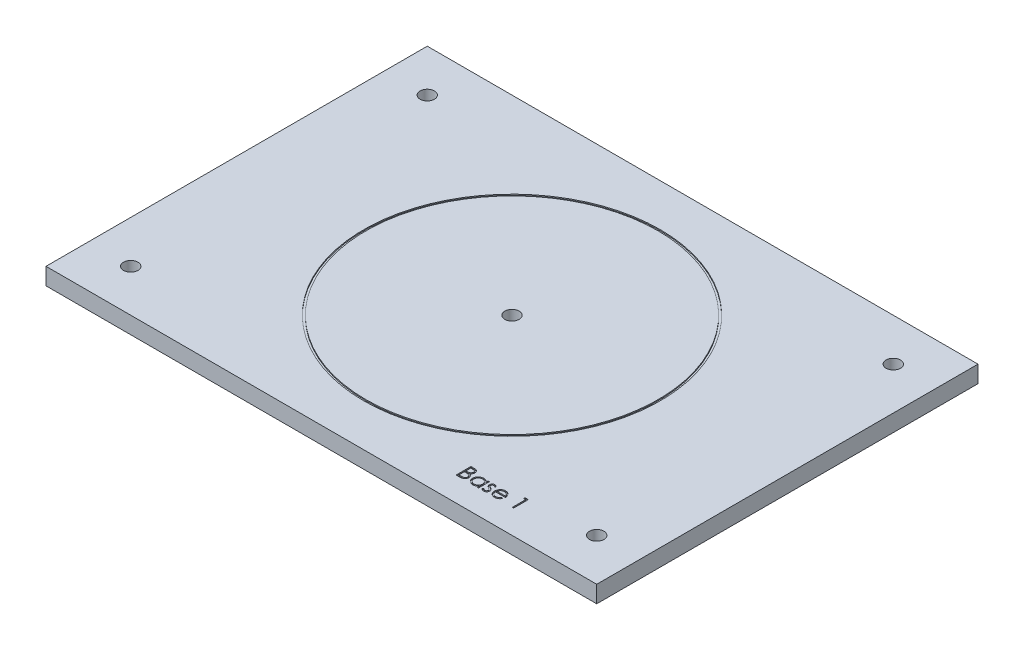
from build123d import *

# Parameters (mm, degrees)
CROQUIS1_W                       = 130
CROQUIS1_H                       = 90
SALIENTE_EXTRUIR1_DEPTH          = 2
TALADRO_DE_MARGEN_PARA_M31_D     = 3.4
TALADRO_DE_MARGEN_PARA_M31_DEPTH = 40
TALADRO_DE_MARGEN_PARA_M31_TIP   = 1.021463052
CORTAR_EXTRUIR1_DEPTH            = 0.25
CROQUIS5_R                       = 35
CROQUIS5_R_2                     = 34.5
CORTAR_EXTRUIR2_DEPTH            = 0.25
TALADRO_DE_MARGEN_PARA_M32_D     = 3.4


with BuildPart() as part:
    # Croquis1 → Saliente-Extruir1 (new, symmetric)
    with BuildSketch(Plane(origin=(0, 0, 0), x_dir=(1, 0, 0), z_dir=(0, 1, 0))):
        Rectangle(CROQUIS1_W, CROQUIS1_H)
    extrude(amount=SALIENTE_EXTRUIR1_DEPTH, both=True)

    # Taladro de margen para M31
    with Locations(Plane(origin=(0, 2, 0), x_dir=(1, 0, 0), z_dir=(0, 1, 0))):
        with Locations((-55, 35), (55, 35), (55, -35), (-55, -35)):
            Hole(TALADRO_DE_MARGEN_PARA_M31_D / 2, depth=TALADRO_DE_MARGEN_PARA_M31_DEPTH)
            with Locations((0, 0, -(TALADRO_DE_MARGEN_PARA_M31_DEPTH + TALADRO_DE_MARGEN_PARA_M31_TIP / 2))):  # 118° drill point
                Cone(0, TALADRO_DE_MARGEN_PARA_M31_D / 2, TALADRO_DE_MARGEN_PARA_M31_TIP, mode=Mode.SUBTRACT)

    # Croquis4 → Cortar-Extruir1 (cut)
    # profile 1 of 5: a face of its own
    with BuildSketch(Plane(origin=(0, 2, 0), x_dir=(1, 0, 0), z_dir=(0, 1, 0))):
        with BuildLine():
            Line((26.072765662, -35.764073187), (26.75565829, -35.764073187))
            add(Edge.make_bspline(
                [(26.75565829, -35.764073187), (26.789086768, -35.764248937), (26.853879479, -35.764589586), (26.94809892, -35.769872717), (27.036347731, -35.777076387), (27.118651503, -35.788506479), (27.194972206, -35.802298256), (27.265539843, -35.819000072), (27.330130015, -35.839026686), (27.407242752, -35.870872967), (27.495163413, -35.918196136), (27.590361805, -35.988124701), (27.671766045, -36.073657164), (27.741952362, -36.170139819), (27.797753482, -36.276275591), (27.838122779, -36.38953478), (27.863680654, -36.508456522), (27.866309088, -36.5900997), (27.867637457, -36.631360847)],
                knots=[0, 0, 0, 0, 1.001505555, 1.941167018, 2.826882275, 3.653841531, 4.429895133, 5.150066043, 5.825578002, 6.45369114, 7.647487171, 8.808567382, 9.977351308, 11.170798116, 12.373658725, 13.556498008, 14.765093433, 16, 16, 16, 16], degree=3))
            add(Edge.make_bspline(
                [(27.867637457, -36.631360847), (27.866544238, -36.670013403), (27.864395961, -36.74596932), (27.843853202, -36.857063429), (27.811692533, -36.962814648), (27.766987284, -37.062837034), (27.708885288, -37.154870647), (27.640026969, -37.239657913), (27.556950167, -37.31360897), (27.494706927, -37.354951872), (27.463090181, -37.375952194)],
                knots=[0, 0, 0, 0, 1.044552857, 2.05264487, 3.044412934, 4.028983338, 5.005914585, 5.980388656, 6.974128949, 8, 8, 8, 8], degree=3))
            add(Edge.make_bspline(
                [(27.463090181, -37.375952194), (27.502850609, -37.391217192), (27.578922156, -37.420422917), (27.683608169, -37.472058381), (27.773803014, -37.528220491), (27.85020016, -37.589552341), (27.915537814, -37.655661152), (27.972590756, -37.727516266), (28.02127213, -37.806055024), (28.062985054, -37.89045856), (28.09553381, -37.979865028), (28.119909714, -38.073435804), (28.133877163, -38.170835359), (28.135864805, -38.237120739), (28.136868226, -38.270583604)],
                knots=[0, 0, 0, 0, 1.27268992, 2.434971085, 3.483601985, 4.442670788, 5.356604649, 6.2567628, 7.179492994, 8.113709626, 9.066344395, 10.018646069, 10.999752585, 12, 12, 12, 12], degree=3))
            add(Edge.make_bspline(
                [(28.136868226, -38.270583604), (28.13589138, -38.304750476), (28.133969408, -38.371974754), (28.119789436, -38.470729889), (28.095780329, -38.565104835), (28.062709183, -38.655710018), (28.019546868, -38.742370152), (27.967018904, -38.825183416), (27.90438734, -38.903317747), (27.834324471, -38.97764137), (27.755062326, -39.044469157), (27.669546571, -39.103984864), (27.576700251, -39.152930926), (27.478048257, -39.194046948), (27.372483941, -39.225454146), (27.260481334, -39.24742672), (27.142137032, -39.262231757), (27.060927281, -39.263448962), (27.019280085, -39.264073187)],
                knots=[0, 0, 0, 0, 0.978564426, 1.925352924, 2.850884081, 3.763762016, 4.682927383, 5.618979971, 6.567305752, 7.547517671, 8.540179244, 9.531824382, 10.526200242, 11.540722885, 12.589160233, 13.674978461, 14.80764778, 16, 16, 16, 16], degree=3))
            Line((27.019280085, -39.264073187), (26.072765662, -39.264073187))
            Line((26.072765662, -39.264073187), (26.072765662, -35.764073187))
        make_face()
        with BuildLine():
            Line((26.386868226, -36.123047546), (26.386868226, -37.244842418))
            Line((26.386868226, -37.244842418), (26.597905886, -37.244842418))
            add(Edge.make_bspline(
                [(26.597905886, -37.244842418), (26.628754682, -37.244442495), (26.688360841, -37.243669762), (26.774680737, -37.241456245), (26.854805756, -37.235258202), (26.928597589, -37.22906194), (26.995940033, -37.218987352), (27.056683894, -37.206995229), (27.111782491, -37.194312324), (27.175322037, -37.172742837), (27.247394985, -37.140865162), (27.324228089, -37.091393326), (27.391962559, -37.032468973), (27.449159747, -36.964478011), (27.495971217, -36.889611825), (27.528484932, -36.809064944), (27.550532216, -36.724844812), (27.552523748, -36.66702656), (27.553534893, -36.637670944)],
                knots=[0, 0, 0, 0, 1.156816544, 2.235205308, 3.236616184, 4.169592532, 5.011045266, 5.787822928, 6.49130361, 7.128639758, 8.301311294, 9.436451833, 10.541879658, 11.654887649, 12.756523258, 13.837046038, 14.901820046, 16, 16, 16, 16], degree=3))
            add(Edge.make_bspline(
                [(27.553534893, -36.637670944), (27.553008713, -36.618245172), (27.551976553, -36.5801394), (27.54352325, -36.524590046), (27.529155676, -36.472346293), (27.510701382, -36.422692183), (27.484912694, -36.377180333), (27.45454923, -36.334237137), (27.41786354, -36.295325018), (27.376106227, -36.25895552), (27.328097605, -36.226710992), (27.273866313, -36.198470229), (27.212678636, -36.175729453), (27.145565781, -36.1558133), (27.071494693, -36.141825006), (26.99132014, -36.130171619), (26.904385421, -36.124238877), (26.844240318, -36.123453514), (26.813150277, -36.123047546)],
                knots=[0, 0, 0, 0, 0.91205012, 1.789085906, 2.630437955, 3.453916878, 4.269457761, 5.079663411, 5.91843418, 6.774407191, 7.675494373, 8.627863946, 9.638891023, 10.736472738, 11.911756761, 13.175263542, 14.539845004, 16, 16, 16, 16], degree=3))
            Line((26.813150277, -36.123047546), (26.386868226, -36.123047546))
        make_face(mode=Mode.SUBTRACT)
        with BuildLine():
            Line((26.386868226, -37.603816777), (26.386868226, -38.905098828))
            Line((26.386868226, -38.905098828), (26.834183931, -38.905098828))
            add(Edge.make_bspline(
                [(26.834183931, -38.905098828), (26.866202857, -38.904715081), (26.927915116, -38.903975458), (27.017016346, -38.901560904), (27.09959945, -38.896068628), (27.175287585, -38.887422778), (27.244898038, -38.878044329), (27.307595741, -38.865433048), (27.363888934, -38.850984088), (27.429163242, -38.828649915), (27.50266675, -38.793953445), (27.581877607, -38.741639218), (27.652303825, -38.67931591), (27.712109084, -38.607184996), (27.761122073, -38.528753669), (27.796777528, -38.445608319), (27.818768385, -38.359122792), (27.821430554, -38.300156079), (27.822765662, -38.270583604)],
                knots=[0, 0, 0, 0, 1.160039823, 2.235823828, 3.228722157, 4.157150951, 4.99529583, 5.772374946, 6.472645482, 7.099169577, 8.269452708, 9.405989375, 10.527446681, 11.663510218, 12.788923519, 13.866172445, 14.929861265, 16, 16, 16, 16], degree=3))
            add(Edge.make_bspline(
                [(27.822765662, -38.270583604), (27.822489558, -38.252090263), (27.821941802, -38.215401881), (27.813681188, -38.161486062), (27.801667318, -38.109260189), (27.786135884, -38.058582448), (27.763516417, -38.010369072), (27.737109872, -37.963666513), (27.70614847, -37.918413033), (27.657904304, -37.86120078), (27.58773232, -37.795283767), (27.488025544, -37.730746265), (27.374653246, -37.678698457), (27.292425753, -37.656598981), (27.249949156, -37.645182963)],
                knots=[0, 0, 0, 0, 0.723448775, 1.435228256, 2.130040452, 2.821711965, 3.505591119, 4.210454504, 4.921174351, 5.648778258, 7.137944449, 8.670945889, 10.280296675, 12, 12, 12, 12], degree=3))
            add(Edge.make_bspline(
                [(27.249949156, -37.645182963), (27.23292006, -37.641727879), (27.195997467, -37.634236544), (27.135789887, -37.626328841), (27.067054018, -37.619283781), (26.989631141, -37.614072623), (26.9034233, -37.60868608), (26.808246381, -37.606591258), (26.704489066, -37.604091998), (26.632496694, -37.603910864), (26.595101399, -37.603816777)],
                knots=[0, 0, 0, 0, 0.634451884, 1.375622551, 2.216452059, 3.157844607, 4.20941857, 5.370758133, 6.634282058, 8, 8, 8, 8], degree=3))
            Line((26.595101399, -37.603816777), (26.386868226, -37.603816777))
        make_face(mode=Mode.SUBTRACT)
    # profile 2 of 5: a face of its own
    with BuildSketch(Plane(origin=(0, 2, 0), x_dir=(1, 0, 0), z_dir=(0, 1, 0))):
        with BuildLine():
            Line((31.367637457, -36.706380879), (31.367637457, -39.264073187))
            Line((31.367637457, -39.264073187), (31.053534893, -39.264073187))
            Line((31.053534893, -39.264073187), (31.053534893, -38.821665335))
            add(Edge.make_bspline(
                [(31.053534893, -38.821665335), (31.018116102, -38.861704928), (30.948995887, -38.9398427), (30.833554769, -39.041924872), (30.711186591, -39.126303194), (30.58248527, -39.194453109), (30.447567026, -39.245645166), (30.306730939, -39.282031325), (30.159919558, -39.30542516), (30.059667203, -39.307761182), (30.008863418, -39.308944982)],
                knots=[0, 0, 0, 0, 1.074387032, 2.096679803, 3.090159297, 4.057316773, 5.018401886, 5.985159533, 6.978961417, 8, 8, 8, 8], degree=3))
            add(Edge.make_bspline(
                [(30.008863418, -39.308944982), (29.963695464, -39.30771861), (29.87462226, -39.305300149), (29.743593182, -39.286537846), (29.617500933, -39.256407224), (29.49622636, -39.214506335), (29.380554215, -39.158925513), (29.269494118, -39.092384265), (29.163621426, -39.013143435), (29.064549887, -38.922555406), (28.973317887, -38.824160419), (28.893256614, -38.719214872), (28.826503534, -38.608172568), (28.770683454, -38.492439415), (28.727687109, -38.371124495), (28.697713475, -38.244647327), (28.678973028, -38.113157454), (28.676555568, -38.02361793), (28.675329764, -37.978215815)],
                knots=[0, 0, 0, 0, 1.033919861, 2.038935746, 3.024066025, 3.998881131, 4.97069526, 5.957263378, 6.95902576, 7.993208707, 9.027059324, 10.027763471, 11.009749337, 11.988697705, 12.965288445, 13.950418724, 14.960734635, 16, 16, 16, 16], degree=3))
            add(Edge.make_bspline(
                [(28.675329764, -37.978215815), (28.676582736, -37.933752112), (28.679059793, -37.845849768), (28.697513013, -37.71657107), (28.728544021, -37.59205281), (28.772091869, -37.472695866), (28.827933824, -37.358355816), (28.895861911, -37.248951791), (28.975881036, -37.144182394), (29.068133443, -37.046511167), (29.168068213, -36.956290553), (29.274976944, -36.877881507), (29.386200225, -36.810164658), (29.503463235, -36.756511182), (29.62503034, -36.713102078), (29.751983786, -36.68306911), (29.883795365, -36.665371788), (29.973285857, -36.662809024), (30.018679123, -36.661509085)],
                knots=[0, 0, 0, 0, 1.020392517, 2.01726096, 2.990465484, 3.961182959, 4.928053699, 5.906110375, 6.912531644, 7.948652711, 8.985773172, 9.998621852, 10.987621588, 11.969261332, 12.953316658, 13.946091881, 14.958173133, 16, 16, 16, 16], degree=3))
            add(Edge.make_bspline(
                [(30.018679123, -36.661509085), (30.070878983, -36.662946836), (30.173240443, -36.665766199), (30.322968452, -36.689228926), (30.46461293, -36.728867393), (30.599267282, -36.782784891), (30.726447968, -36.854433621), (30.844950952, -36.944813582), (30.956016435, -37.053354769), (31.020396727, -37.136725213), (31.053534893, -37.179638091)],
                knots=[0, 0, 0, 0, 1.038897134, 2.037228247, 3.008116434, 3.962042015, 4.918381754, 5.904844433, 6.921570401, 8, 8, 8, 8], degree=3))
            Line((31.053534893, -37.179638091), (31.053534893, -36.706380879))
            Line((31.053534893, -36.706380879), (31.367637457, -36.706380879))
        make_face()
        with BuildLine():
            add(Edge.make_bspline(
                [(30.022885854, -36.975611649), (29.976971516, -36.977245286), (29.886343916, -36.980469827), (29.753299914, -37.005643323), (29.6259865, -37.047527917), (29.505040426, -37.104809818), (29.392372209, -37.176838555), (29.291678539, -37.263959938), (29.202135837, -37.363796952), (29.126827573, -37.475899063), (29.065437076, -37.596077154), (29.022270044, -37.721701592), (28.993800797, -37.850506569), (28.990892276, -37.937869255), (28.989432329, -37.981721424)],
                knots=[0, 0, 0, 0, 1.031046209, 2.035121221, 3.029706178, 4.034933723, 5.034054252, 6.02443088, 7.017295772, 8.038157696, 9.050218397, 10.03989886, 11.016116709, 12, 12, 12, 12], degree=3))
            add(Edge.make_bspline(
                [(28.989432329, -37.981721424), (28.991297222, -38.025311531), (28.995019699, -38.112320887), (29.021770393, -38.241301464), (29.066650267, -38.366955506), (29.127892329, -38.4882165), (29.204578954, -38.6008006), (29.293467607, -38.702540723), (29.395417888, -38.790030311), (29.508345395, -38.863267884), (29.628953365, -38.922430405), (29.755787297, -38.963596045), (29.886462935, -38.990173826), (29.975315269, -38.993278302), (30.020081367, -38.994842418)],
                knots=[0, 0, 0, 0, 0.979072187, 1.954306742, 2.945804271, 3.96968567, 4.997920485, 5.998718438, 6.996577872, 8.005894225, 9.015743152, 10.005417472, 10.995077863, 12, 12, 12, 12], degree=3))
            add(Edge.make_bspline(
                [(30.020081367, -38.994842418), (30.06552787, -38.993182454), (30.155916456, -38.98988095), (30.289355164, -38.964599685), (30.418850127, -38.922830887), (30.542637355, -38.86493176), (30.657953487, -38.793174404), (30.761451364, -38.709167313), (30.848967333, -38.611464129), (30.923159942, -38.504087676), (30.981335359, -38.386375679), (31.023711418, -38.261041489), (31.048765324, -38.128080741), (31.051923053, -38.037216814), (31.053534893, -37.990836008)],
                knots=[0, 0, 0, 0, 1.01762866, 2.023962475, 3.030623092, 4.058876274, 5.077231937, 6.066672613, 7.034107872, 8.005628644, 8.981990164, 9.965428785, 10.961468474, 12, 12, 12, 12], degree=3))
            add(Edge.make_bspline(
                [(31.053534893, -37.990836008), (31.052575236, -37.955498177), (31.050686329, -37.885942144), (31.036255759, -37.783814626), (31.013300833, -37.6860809), (30.980954663, -37.592638211), (30.938463379, -37.504003196), (30.887215613, -37.419539435), (30.826310163, -37.339686224), (30.756727467, -37.265543153), (30.680562264, -37.197916691), (30.599967724, -37.13755245), (30.513988977, -37.087963677), (30.42407194, -37.046922406), (30.330060605, -37.014263256), (30.231189985, -36.992475562), (30.128510999, -36.977515241), (30.058464943, -36.97625286), (30.022885854, -36.975611649)],
                knots=[0, 0, 0, 0, 1.050140795, 2.067009409, 3.05949893, 4.030605086, 5.00011959, 5.97591094, 6.962425594, 7.979863591, 8.993523472, 9.986985069, 10.967611495, 11.937549037, 12.921786183, 13.919465291, 14.943216303, 16, 16, 16, 16], degree=3))
        make_face(mode=Mode.SUBTRACT)
    # profile 3 of 5: a face of its own
    with BuildSketch(Plane(origin=(0, 2, 0), x_dir=(1, 0, 0), z_dir=(0, 1, 0))):
        with BuildLine():
            Line((33.297124636, -37.025391296), (33.083983611, -37.244842418))
            add(Edge.make_bspline(
                [(33.083983611, -37.244842418), (33.065593107, -37.223529272), (33.030138381, -37.182440034), (32.9739069, -37.127502968), (32.917883297, -37.081366029), (32.862834483, -37.04241377), (32.807376214, -37.012964624), (32.752159296, -36.991469762), (32.697126557, -36.978167956), (32.660340522, -36.976453517), (32.64227688, -36.975611649)],
                knots=[0, 0, 0, 0, 1.26578478, 2.440284043, 3.530471711, 4.527705817, 5.468200915, 6.346673037, 7.188140097, 8, 8, 8, 8], degree=3))
            add(Edge.make_bspline(
                [(32.64227688, -36.975611649), (32.62013749, -36.976686522), (32.576570304, -36.97880172), (32.514144486, -36.99991515), (32.456193861, -37.032323888), (32.406036881, -37.078292472), (32.363549201, -37.131056741), (32.33253552, -37.190053066), (32.313569536, -37.253501109), (32.311164804, -37.297530967), (32.309945149, -37.31986245)],
                knots=[0, 0, 0, 0, 0.99966794, 1.967205029, 2.953328237, 3.988086729, 5.028030931, 6.008226631, 6.989793394, 8, 8, 8, 8], degree=3))
            add(Edge.make_bspline(
                [(32.309945149, -37.31986245), (32.311055961, -37.340074494), (32.313274455, -37.380441605), (32.330521134, -37.439989639), (32.357987206, -37.498046677), (32.3836574, -37.533609583), (32.396884252, -37.551933764)],
                knots=[0, 0, 0, 0, 0.960159726, 1.917612774, 2.927026955, 4, 4, 4, 4], degree=3))
            add(Edge.make_bspline(
                [(32.396884252, -37.551933764), (32.404847745, -37.561718348), (32.421797038, -37.582543603), (32.453605553, -37.611447456), (32.489628056, -37.643389707), (32.532947994, -37.675326544), (32.581699022, -37.708958269), (32.636938306, -37.742960402), (32.696912811, -37.779924827), (32.739850118, -37.803369263), (32.762168707, -37.815555559)],
                knots=[0, 0, 0, 0, 0.66740084, 1.420478572, 2.27185888, 3.217733974, 4.268547843, 5.408967954, 6.65319498, 8, 8, 8, 8], degree=3))
            add(Edge.make_bspline(
                [(32.762168707, -37.815555559), (32.789382284, -37.830800462), (32.841949954, -37.860248594), (32.916642721, -37.905958298), (32.984429762, -37.951389722), (33.04588543, -37.996056996), (33.099827239, -38.041209863), (33.147891791, -38.08511762), (33.188880235, -38.129106929), (33.211834162, -38.159840042), (33.222805726, -38.174529918)],
                knots=[0, 0, 0, 0, 1.27191281, 2.456916733, 3.569705269, 4.599008579, 5.553216877, 6.436649441, 7.252746552, 8, 8, 8, 8], degree=3))
            add(Edge.make_bspline(
                [(33.222805726, -38.174529918), (33.241016253, -38.204196006), (33.277258583, -38.263237027), (33.315316849, -38.360455454), (33.337377124, -38.463565957), (33.340439344, -38.534098177), (33.341996431, -38.56996261)],
                knots=[0, 0, 0, 0, 0.995354457, 1.980940102, 2.973342416, 4, 4, 4, 4], degree=3))
            add(Edge.make_bspline(
                [(33.341996431, -38.56996261), (33.341276897, -38.595231756), (33.339858977, -38.64502737), (33.33000091, -38.718362199), (33.313045934, -38.788496757), (33.28995218, -38.856192041), (33.258767807, -38.920150981), (33.22222001, -38.98198723), (33.178345098, -39.040363161), (33.128253723, -39.095202121), (33.073408229, -39.145287868), (33.01490209, -39.189311822), (32.95266326, -39.22588616), (32.887136458, -39.256151505), (32.818172804, -39.280219763), (32.745761515, -39.296882294), (32.67013276, -39.306855055), (32.618702952, -39.308239531), (32.592497232, -39.308944982)],
                knots=[0, 0, 0, 0, 1.032770009, 2.035186124, 3.017557409, 3.978232242, 4.952395191, 5.920591857, 6.910227898, 7.931268572, 8.952309245, 9.941945286, 10.918353717, 11.897095711, 12.887975737, 13.898235213, 14.929059601, 16, 16, 16, 16], degree=3))
            add(Edge.make_bspline(
                [(32.592497232, -39.308944982), (32.557130057, -39.307952282), (32.48688713, -39.305980674), (32.382997411, -39.287474613), (32.281476652, -39.258679219), (32.183093112, -39.218963285), (32.090046998, -39.168812572), (32.004916073, -39.108750179), (31.927404611, -39.040760181), (31.883286337, -38.988647271), (31.8612272, -38.962590815)],
                knots=[0, 0, 0, 0, 1.013940152, 2.01379169, 3.017749504, 4.037548394, 5.051665909, 6.043208538, 7.021604269, 8, 8, 8, 8], degree=3))
            Line((31.8612272, -38.962590815), (32.069460373, -38.725611649))
            add(Edge.make_bspline(
                [(32.069460373, -38.725611649), (32.089232786, -38.746966413), (32.127564599, -38.788365853), (32.188865815, -38.843490194), (32.251245217, -38.889691465), (32.314079903, -38.92833488), (32.378299997, -38.958110283), (32.443545612, -38.979028877), (32.509684036, -38.992473069), (32.554106172, -38.994051351), (32.576371431, -38.994842418)],
                knots=[0, 0, 0, 0, 1.179806542, 2.287233372, 3.337373186, 4.324005949, 5.273901747, 6.200048787, 7.097828587, 8, 8, 8, 8], degree=3))
            add(Edge.make_bspline(
                [(32.576371431, -38.994842418), (32.606689357, -38.993471593), (32.665925499, -38.990793231), (32.750769257, -38.966476139), (32.829107884, -38.928346187), (32.897131229, -38.874261489), (32.95503339, -38.811305917), (32.996961565, -38.740391797), (33.02323774, -38.663600341), (33.026323739, -38.610368038), (33.027893867, -38.583283924)],
                knots=[0, 0, 0, 0, 1.072336372, 2.095165389, 3.102688358, 4.141489647, 5.156069229, 6.117746104, 7.042326257, 8, 8, 8, 8], degree=3))
            add(Edge.make_bspline(
                [(33.027893867, -38.583283924), (33.026807573, -38.560974306), (33.02466283, -38.51692695), (33.007819558, -38.453176609), (32.981206706, -38.392707328), (32.955002057, -38.357317681), (32.941655886, -38.33929354)],
                knots=[0, 0, 0, 0, 1.013901739, 2.00181326, 2.98231254, 4, 4, 4, 4], degree=3))
            add(Edge.make_bspline(
                [(32.941655886, -38.33929354), (32.933633492, -38.330258178), (32.916157819, -38.310575895), (32.884102578, -38.282150817), (32.845720716, -38.251512717), (32.800580553, -38.219181129), (32.748591091, -38.185582523), (32.689541616, -38.150893171), (32.624241063, -38.113465445), (32.578070432, -38.08864579), (32.553935534, -38.075671745)],
                knots=[0, 0, 0, 0, 0.615000592, 1.339693406, 2.178160186, 3.116406724, 4.166410947, 5.330106347, 6.604359322, 8, 8, 8, 8], degree=3))
            add(Edge.make_bspline(
                [(32.553935534, -38.075671745), (32.527888894, -38.061132613), (32.477376146, -38.032936597), (32.405828855, -37.989020517), (32.341281501, -37.944353242), (32.282180926, -37.901440403), (32.230019921, -37.858019459), (32.185003972, -37.814042207), (32.145360757, -37.771282221), (32.123413345, -37.740984925), (32.112929925, -37.726513091)],
                knots=[0, 0, 0, 0, 1.262093308, 2.447601706, 3.550203992, 4.582594899, 5.537233252, 6.418365656, 7.244515135, 8, 8, 8, 8], degree=3))
            add(Edge.make_bspline(
                [(32.112929925, -37.726513091), (32.094799325, -37.697367476), (32.05853179, -37.639066061), (32.023316599, -37.541755584), (31.99911057, -37.439310527), (31.99694818, -37.368623672), (31.995842585, -37.332482642)],
                knots=[0, 0, 0, 0, 0.985009483, 1.970363186, 2.962279964, 4, 4, 4, 4], degree=3))
            add(Edge.make_bspline(
                [(31.995842585, -37.332482642), (31.99637678, -37.308857244), (31.997422276, -37.262618993), (32.005766328, -37.194680173), (32.020958039, -37.130132019), (32.040012962, -37.068005156), (32.066495966, -37.009503062), (32.098141871, -36.953845591), (32.135329296, -36.901109673), (32.178172587, -36.852106541), (32.225279232, -36.807597215), (32.276174002, -36.768798587), (32.329712259, -36.735692232), (32.386120678, -36.707927071), (32.445941151, -36.686925689), (32.508755537, -36.672468304), (32.574436692, -36.662813101), (32.619337818, -36.661950017), (32.64227688, -36.661509085)],
                knots=[0, 0, 0, 0, 1.087655834, 2.128696564, 3.144119009, 4.137814668, 5.115653402, 6.093965665, 7.082169637, 8.081268856, 9.086088321, 10.061021666, 11.022561449, 11.980240094, 12.950172527, 13.934149372, 14.944599409, 16, 16, 16, 16], degree=3))
            add(Edge.make_bspline(
                [(32.64227688, -36.661509085), (32.669468943, -36.662613425), (32.724363165, -36.664842823), (32.806717791, -36.682548514), (32.888951133, -36.711681618), (32.971274483, -36.751917851), (33.053084773, -36.803984727), (33.135101629, -36.866914026), (33.21830966, -36.940291741), (33.270265973, -36.996390966), (33.297124636, -37.025391296)],
                knots=[0, 0, 0, 0, 0.845714091, 1.707292901, 2.609013841, 3.555613372, 4.552488639, 5.621697636, 6.770543573, 8, 8, 8, 8], degree=3))
        make_face()
    # profile 4 of 5: a face of its own
    with BuildSketch(Plane(origin=(0, 2, 0), x_dir=(1, 0, 0), z_dir=(0, 1, 0))):
        with BuildLine():
            Line((36.069360213, -38.456380879), (36.348406688, -38.602915335))
            add(Edge.make_bspline(
                [(36.348406688, -38.602915335), (36.326170092, -38.642358666), (36.282906484, -38.719099769), (36.208505736, -38.824531629), (36.130513663, -38.919379345), (36.045409695, -39.001108999), (35.955740016, -39.072360384), (35.861007362, -39.134698209), (35.760718544, -39.187816729), (35.654868819, -39.232569257), (35.542569268, -39.266978751), (35.423547752, -39.291282972), (35.297576256, -39.306306241), (35.211230076, -39.308051382), (35.167016463, -39.308944982)],
                knots=[0, 0, 0, 0, 1.120438281, 2.179929193, 3.190490725, 4.156257408, 5.095198341, 6.022838206, 6.959905092, 7.901321166, 8.864066838, 9.862729781, 10.905609505, 12, 12, 12, 12], degree=3))
            add(Edge.make_bspline(
                [(35.167016463, -39.308944982), (35.117874486, -39.307797807), (35.022012724, -39.30556), (34.882472977, -39.286267535), (34.751093558, -39.254795177), (34.627881855, -39.210829635), (34.513139603, -39.153402311), (34.406638748, -39.083442829), (34.307819222, -39.001310575), (34.219795013, -38.906294131), (34.14055113, -38.804612174), (34.07062531, -38.698656289), (34.012167879, -38.588693065), (33.964615269, -38.475422541), (33.926210404, -38.359558647), (33.8994437, -38.24004718), (33.884013952, -38.117211596), (33.881649507, -38.03411426), (33.88045797, -37.992238251)],
                knots=[0, 0, 0, 0, 1.145258523, 2.234067595, 3.276747158, 4.290159414, 5.277019952, 6.260822364, 7.254936242, 8.264827045, 9.274100331, 10.257902744, 11.220704747, 12.172965371, 13.118907548, 14.062713208, 15.023725156, 16, 16, 16, 16], degree=3))
            add(Edge.make_bspline(
                [(33.88045797, -37.992238251), (33.881517111, -37.952943421), (33.883616189, -37.875066256), (33.896846977, -37.759800712), (33.92029527, -37.647772259), (33.952471594, -37.538887811), (33.99402284, -37.433329677), (34.044855059, -37.331033613), (34.105047437, -37.232108474), (34.151520111, -37.16970534), (34.174929123, -37.138271905)],
                knots=[0, 0, 0, 0, 1.024358464, 2.0301432, 3.019427413, 4.004406732, 4.986367066, 5.972626655, 6.978780325, 8, 8, 8, 8], degree=3))
            add(Edge.make_bspline(
                [(34.174929123, -37.138271905), (34.206636806, -37.100403035), (34.269047753, -37.025864885), (34.374604108, -36.927926559), (34.488904305, -36.845882784), (34.610515931, -36.777875647), (34.740852405, -36.726202), (34.878161696, -36.687694418), (35.024007282, -36.666116407), (35.123712503, -36.663068574), (35.174728803, -36.661509085)],
                knots=[0, 0, 0, 0, 1.030682036, 2.02871468, 2.997146059, 3.962720338, 4.930598197, 5.918074684, 6.934738563, 8, 8, 8, 8], degree=3))
            add(Edge.make_bspline(
                [(35.174728803, -36.661509085), (35.227176408, -36.662863133), (35.330066654, -36.665519469), (35.480098775, -36.690145802), (35.622059492, -36.729198357), (35.755891996, -36.784352147), (35.881609857, -36.855511699), (35.998395906, -36.94365354), (36.108247419, -37.046071628), (36.172155998, -37.124834837), (36.20467672, -37.164914533)],
                knots=[0, 0, 0, 0, 1.056321875, 2.072262726, 3.055038591, 4.01806755, 4.982017516, 5.957941055, 6.960871419, 8, 8, 8, 8], degree=3))
            add(Edge.make_bspline(
                [(36.20467672, -37.164914533), (36.226803658, -37.195118115), (36.270910251, -37.255324233), (36.326157351, -37.35349539), (36.374114746, -37.456205985), (36.412447707, -37.565116282), (36.443487208, -37.678935862), (36.465944027, -37.798478407), (36.479113646, -37.923708318), (36.481702343, -38.009034874), (36.483022072, -38.052534726)],
                knots=[0, 0, 0, 0, 0.94817472, 1.890038105, 2.849395472, 3.817997239, 4.812318967, 5.836947057, 6.897266129, 8, 8, 8, 8], degree=3))
            Line((36.483022072, -38.052534726), (34.194560534, -38.052534726))
            add(Edge.make_bspline(
                [(34.194560534, -38.052534726), (34.19610014, -38.08623519), (34.199127714, -38.152505794), (34.213242857, -38.249476577), (34.235491631, -38.341849919), (34.266760694, -38.428932961), (34.304627539, -38.511863088), (34.351013256, -38.590025125), (34.40635281, -38.663063055), (34.468078509, -38.731630193), (34.536785604, -38.792690954), (34.609068352, -38.84734273), (34.685961917, -38.893148327), (34.76686, -38.930328217), (34.851631785, -38.959434533), (34.94030398, -38.979302354), (35.032702097, -38.99260946), (35.095687831, -38.994089126), (35.127753643, -38.994842418)],
                knots=[0, 0, 0, 0, 1.094153842, 2.151609401, 3.174256925, 4.172055639, 5.149267565, 6.128595816, 7.11444997, 8.118368179, 9.117203808, 10.09244225, 11.054858984, 12.015122123, 12.976791628, 13.957293641, 14.960065497, 16, 16, 16, 16], degree=3))
            add(Edge.make_bspline(
                [(35.127753643, -38.994842418), (35.15910479, -38.994234361), (35.221311481, -38.99302786), (35.313952339, -38.981295949), (35.405091866, -38.962325674), (35.494352849, -38.936435684), (35.579923695, -38.904858831), (35.659169245, -38.866755974), (35.732049461, -38.824606227), (35.800166427, -38.776396552), (35.866237421, -38.717388365), (35.931779907, -38.643752644), (36.002056561, -38.556665116), (36.046046153, -38.49111945), (36.069360213, -38.456380879)],
                knots=[0, 0, 0, 0, 0.99110716, 1.966546729, 2.947904876, 3.932708344, 4.903319531, 5.828989031, 6.710028674, 7.56322171, 8.463672341, 9.504779593, 10.677557249, 12, 12, 12, 12], degree=3))
        make_face()
        with BuildLine():
            add(Edge.make_bspline(
                [(36.168919508, -37.738432161), (36.157422884, -37.696769288), (36.135295582, -37.616581667), (36.089059218, -37.505540777), (36.036987677, -37.406852876), (35.975365946, -37.321273243), (35.90554722, -37.24526973), (35.824902037, -37.178851144), (35.734466144, -37.119433693), (35.634707003, -37.069281194), (35.529065218, -37.026591335), (35.418459026, -36.997966219), (35.305601238, -36.978356677), (35.229266952, -36.976530569), (35.190854604, -36.975611649)],
                knots=[0, 0, 0, 0, 1.154881502, 2.222775134, 3.210006277, 4.132804581, 5.035138423, 5.962687519, 6.919655026, 7.923214229, 8.944639381, 9.960483929, 10.97369054, 12, 12, 12, 12], degree=3))
            add(Edge.make_bspline(
                [(35.190854604, -36.975611649), (35.159505166, -36.97622332), (35.097533917, -36.977432466), (35.006232848, -36.988902596), (34.91855315, -37.00786244), (34.833847862, -37.033827397), (34.753226994, -37.068436), (34.675032225, -37.109019226), (34.601251829, -37.15856081), (34.555110534, -37.196319665), (34.531800117, -37.215395302)],
                knots=[0, 0, 0, 0, 1.04873581, 2.073130211, 3.073294108, 4.04793562, 5.032784715, 6.005352987, 6.992311501, 8, 8, 8, 8], degree=3))
            add(Edge.make_bspline(
                [(34.531800117, -37.215395302), (34.515106835, -37.230489618), (34.481323701, -37.261036834), (34.436183179, -37.313666041), (34.392962707, -37.370417603), (34.353629054, -37.433462727), (34.317551467, -37.502083506), (34.28379149, -37.575701142), (34.253405078, -37.654874272), (34.236308968, -37.710046711), (34.227513258, -37.738432161)],
                knots=[0, 0, 0, 0, 0.879870761, 1.780643979, 2.707998968, 3.669668524, 4.684282772, 5.740141944, 6.837334558, 8, 8, 8, 8], degree=3))
            Line((34.227513258, -37.738432161), (36.168919508, -37.738432161))
        make_face(mode=Mode.SUBTRACT)
    # profile 5 of 5: a face of its own
    with BuildSketch(Plane(origin=(0, 2, 0), x_dir=(1, 0, 0), z_dir=(0, 1, 0))):
        Polygon((38.976912297, -35.764073187), (39.624047713, -35.764073187), (39.624047713, -39.264073187), (39.309945149, -39.264073187), (39.309945149, -36.123047546), (38.771483611, -36.123047546), align=None)
    extrude(amount=-CORTAR_EXTRUIR1_DEPTH, mode=Mode.SUBTRACT)

    # Croquis5 → Cortar-Extruir2 (cut)
    with BuildSketch(Plane(origin=(0, 2, 0), x_dir=(1, 0, 0), z_dir=(0, 1, 0))):
        with Locations(Location((0, 0, 0), (0, 0, 270))):
            Circle(CROQUIS5_R)
        with Locations(Location((0, 0, 0), (0, 0, 270))):
            Circle(CROQUIS5_R_2, mode=Mode.SUBTRACT)
    extrude(amount=-CORTAR_EXTRUIR2_DEPTH, mode=Mode.SUBTRACT)

    # Taladro de margen para M32 (through all)
    with Locations(Plane(origin=(0, 2, 0), x_dir=(1, 0, 0), z_dir=(0, 1, 0))):
        with Locations((0, 0)):
            Hole(TALADRO_DE_MARGEN_PARA_M32_D / 2)


solid = part.part
